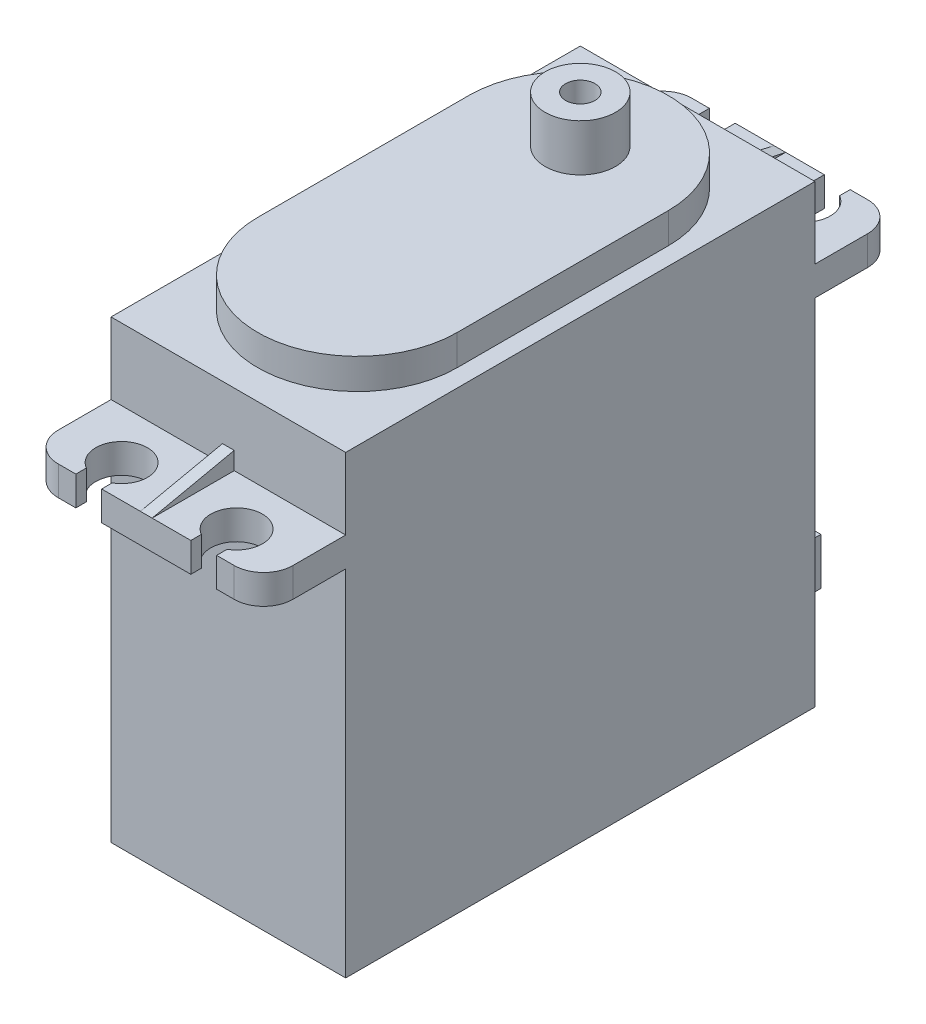
from build123d import *

# Parameters (mm, degrees)
SKETCH_1_W      = 20
SKETCH_1_H      = 40
EXTRUDE_1_DEPTH = 38.8
EXTRUDE_START   = 32.7
EXTRUDE_2_DEPTH = 2.5
EXTRUDE_3_DEPTH = 0.5
EXTRUDE_START_2 = 38.8
EXTRUDE_4_DEPTH = 2.6
EXTRUDE_START_3 = 41.4
SKETCH_5_R      = 3
SKETCH_5_R_2    = 1.25
EXTRUDE_5_DEPTH = 4
EXTRUDE_START_4 = -20
SKETCH_6_W      = 7
SKETCH_6_H      = 4
EXTRUDE_6_DEPTH = 7


with BuildPart() as part:
    # 草图1 → 凸台-拉伸1 (new body)
    with BuildSketch(Plane(origin=(0, 0, 0), x_dir=(1, 0, 0), z_dir=(0, 1, 0))):
        Rectangle(SKETCH_1_W, SKETCH_1_H)
    extrude(amount=EXTRUDE_1_DEPTH)

    # 草图2 → 凸台-拉伸2 (add)
    with BuildSketch(Plane(origin=(0, 0, 0), x_dir=(1, 0, 0), z_dir=(0, 1, 0)).offset(EXTRUDE_START)):
        with BuildLine():
            Line((-7.5, -27), (-6, -27))
            Line((-6, -27), (-6, -26.105255888))
            ThreePointArc((-6, -26.105255888), (-4.9, -22), (-3.8, -26.105255888))
            Line((-3.8, -26.105255888), (-3.8, -27))
            Line((-3.8, -27), (3.8, -27))
            Line((3.8, -27), (3.8, -26.105255888))
            ThreePointArc((3.8, -26.105255888), (4.9, -22), (6, -26.105255888))
            Line((6, -26.105255888), (6, -27))
            Line((6, -27), (7.5, -27))
            ThreePointArc((7.5, -27), (9.267766953, -26.267766953), (10, -24.5))
            Line((10, -24.5), (10, 24.5))
            ThreePointArc((10, 24.5), (9.267766953, 26.267766953), (7.5, 27))
            Line((7.5, 27), (6, 27))
            Line((6, 27), (6, 26.105255888))
            ThreePointArc((6, 26.105255888), (4.9, 22), (3.8, 26.105255888))
            Line((3.8, 26.105255888), (3.8, 27))
            Line((3.8, 27), (-3.8, 27))
            Line((-3.8, 27), (-3.8, 26.105255888))
            ThreePointArc((-3.8, 26.105255888), (-4.9, 22), (-6, 26.105255888))
            Line((-6, 26.105255888), (-6, 27))
            Line((-6, 27), (-7.5, 27))
            ThreePointArc((-7.5, 27), (-9.267766953, 26.267766953), (-10, 24.5))
            Line((-10, 24.5), (-10, -24.5))
            ThreePointArc((-10, -24.5), (-9.267766953, -26.267766953), (-7.5, -27))
        make_face()
    extrude(amount=-EXTRUDE_2_DEPTH)

    # 草图3 → 凸台-拉伸3 (add, symmetric)
    with BuildSketch(Plane(origin=(0, 0, 0), x_dir=(0, 0, -1), z_dir=(1, 0, 0))):
        Polygon((-20, 32.7), (-27, 32.7), (-20, 34.2), align=None)
        Polygon((20, 34.2), (20, 32.7), (27, 32.7), align=None)
    extrude(amount=EXTRUDE_3_DEPTH, both=True)

    # 草图4 → 凸台-拉伸4 (add)
    with BuildSketch(Plane(origin=(0, 0, 0), x_dir=(1, 0, 0), z_dir=(0, 1, 0)).offset(EXTRUDE_START_2)):
        with BuildLine():
            Line((8.5, -9), (8.5, 9))
            ThreePointArc((8.5, 9), (0, 17.5), (-8.5, 9))
            Line((-8.5, 9), (-8.5, -9))
            ThreePointArc((-8.5, -9), (0, -17.5), (8.5, -9))
        make_face()
    extrude(amount=EXTRUDE_4_DEPTH)


with BuildPart() as body_2:
    # 草图5 → 凸台-拉伸5 (new body)
    with BuildSketch(Plane(origin=(0, 0, 0), x_dir=(1, 0, 0), z_dir=(0, 1, 0)).offset(EXTRUDE_START_3)):
        with Locations(Location((0, 10, 0), (0, 0, 270))):
            Circle(SKETCH_5_R)
        with Locations(Location((0, 10, 0), (0, 0, 270))):
            Circle(SKETCH_5_R_2, mode=Mode.SUBTRACT)
    extrude(amount=EXTRUDE_5_DEPTH)


with BuildPart() as body_3:
    # 草图6 → 凸台-拉伸6 (new body)
    with BuildSketch(Plane.XY.offset(EXTRUDE_START_4)):
        with Locations((0, 4)):
            Rectangle(SKETCH_6_W, SKETCH_6_H)
    extrude(amount=-EXTRUDE_6_DEPTH)


solid = Compound([part.part, body_2.part, body_3.part])
